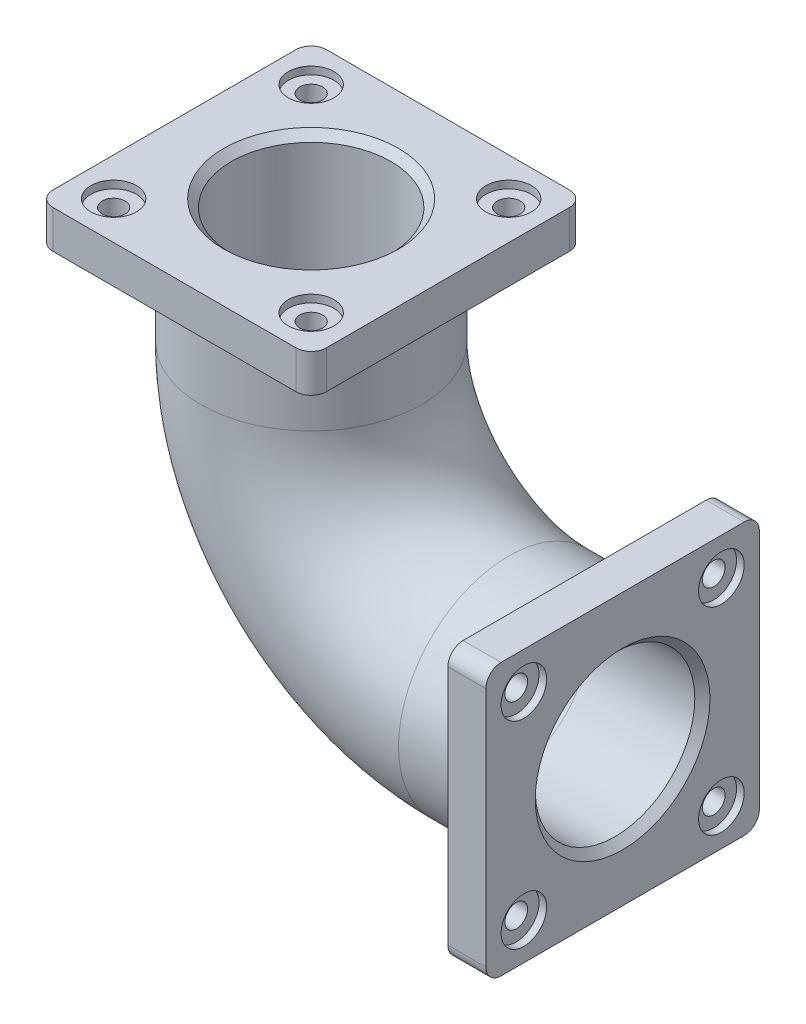
from build123d import *

# Parameters (mm, degrees)
SCHIZZO2_R                   = 145
SCHIZZO2_R_2                 = 105
ESTRUSIONE_ESTRUSIONE2_START = -50
SCHIZZO5_W                   = 360
SCHIZZO5_H                   = 357.468314384
SCHIZZO5_R                   = 145
ESTRUSIONE_ESTRUSIONE2_DEPTH = 50
RACCORDO2_R                  = 20
SCHIZZO11_R                  = 145
ESTRUSIONE_ESTRUSIONE3_DEPTH = 50
SCHIZZO12_R                  = 30
TAGLIO_ESTRUSIONE1_DEPTH     = 10
TAGLIO_ESTRUSIONE2_REACH     = 741.709
SCHIZZO13_R                  = 15
RIPETIZIONECIRCOLARE1_COUNT  = 4
SCHIZZO14_R                  = 30
TAGLIO_ESTRUSIONE3_DEPTH     = 10
TAGLIO_ESTRUSIONE4_REACH     = 856.322
SCHIZZO16_R                  = 15
RIPETIZIONECIRCOLARE2_COUNT  = 4
SMUSSO1_SIZE                 = 10


with BuildPart() as part:
    # Sweep-Sottile1: sweep along a path in Schizzo1
    with BuildLine(Plane.XY) as sweep_sottile1_path:
        Line((0, 0), (-150, 0))
        ThreePointArc((-150, 0), (-333.847763109, 76.152236891), (-410, 260))
        Line((-410, 260), (-410, 422.338378292))
    # Schizzo2 → Sweep-Sottile1 (sweep)
    with BuildSketch(Plane(origin=(0, 0, 0), x_dir=(0, 0, -1), z_dir=(1, 0, 0))):
        Circle(SCHIZZO2_R)
        Circle(SCHIZZO2_R_2, mode=Mode.SUBTRACT)
    sweep(path=sweep_sottile1_path.line)

    # Schizzo5 → Estrusione-Estrusione2 (add)
    with BuildSketch(Plane(origin=(0, 0, 0), x_dir=(0, 0, -1), z_dir=(1, 0, 0)).offset(ESTRUSIONE_ESTRUSIONE2_START)):
        Rectangle(SCHIZZO5_W, SCHIZZO5_H)
        with Locations(Location((0, 0, 0), (0, 0, 270))):
            Circle(SCHIZZO5_R, mode=Mode.SUBTRACT)
    extrude(amount=ESTRUSIONE_ESTRUSIONE2_DEPTH)

    # Raccordo2
    raccordo2_edges = [part.edges().sort_by_distance(p)[0] for p in [
        (-25, -178.734157192, -180),
        (-25, -178.734157192, 180),
        (-25, 178.734157192, 180),
        (-25, 178.734157192, -180),
    ]]
    fillet(raccordo2_edges, radius=RACCORDO2_R)

    # Schizzo11 → Estrusione-Estrusione3 (add)
    with BuildSketch(Plane(origin=(0, 422.338378292, 0), x_dir=(1, 0, 0), z_dir=(0, 1, 0))):
        with BuildLine():
            ThreePointArc((-250, 180), (-235.857864376, 174.142135624), (-230, 160))
            Line((-230, 160), (-230, -160))
            ThreePointArc((-230, -160), (-235.857864376, -174.142135624), (-250, -180))
            Line((-250, -180), (-570, -180))
            ThreePointArc((-570, -180), (-584.142135624, -174.142135624), (-590, -160))
            Line((-590, -160), (-590, 160))
            ThreePointArc((-590, 160), (-584.142135624, 174.142135624), (-570, 180))
            Line((-570, 180), (-250, 180))
        make_face()
        with Locations(Location((-410, 0, 0), (0, 0, 270))):
            Circle(SCHIZZO11_R, mode=Mode.SUBTRACT)
    extrude(amount=-ESTRUSIONE_ESTRUSIONE3_DEPTH)

    # Schizzo12 → Taglio-Estrusione1 (cut)
    with BuildSketch(Plane(origin=(0, 0, 0), x_dir=(0, 0, -1), z_dir=(1, 0, 0))):
        with Locations((-130, 130)):
            Circle(SCHIZZO12_R)
    taglio_estrusione1 = extrude(amount=-TAGLIO_ESTRUSIONE1_DEPTH, mode=Mode.SUBTRACT)

    # Schizzo13 → Taglio-Estrusione2 (cut, up to next)
    with BuildSketch(Plane(origin=(-10, 0, 0), x_dir=(0, 0, -1), z_dir=(1, 0, 0)), mode=Mode.PRIVATE) as taglio_estrusione2_sk1:
        with Locations((-130, 130)):
            Circle(SCHIZZO13_R)
    taglio_estrusione2_tool1 = extrude(taglio_estrusione2_sk1.sketch, amount=-TAGLIO_ESTRUSIONE2_REACH, mode=Mode.PRIVATE) & part.part
    taglio_estrusione2 = taglio_estrusione2_tool1.solids().sort_by_distance((-10, 130, 130))[0]
    add(taglio_estrusione2, mode=Mode.SUBTRACT)

    # RipetizioneCircolare1: Taglio-Estrusione1, Taglio-Estrusione2 ×4 about axis
    ripetizionecircolare1_axis = Axis((0, 0, 0), (1, 0, 0))
    add([taglio_estrusione1.rotate(ripetizionecircolare1_axis, i * 360 / RIPETIZIONECIRCOLARE1_COUNT) for i in range(1, RIPETIZIONECIRCOLARE1_COUNT)], mode=Mode.SUBTRACT)
    add([taglio_estrusione2.rotate(ripetizionecircolare1_axis, i * 360 / RIPETIZIONECIRCOLARE1_COUNT) for i in range(1, RIPETIZIONECIRCOLARE1_COUNT)], mode=Mode.SUBTRACT)

    # Schizzo14 → Taglio-Estrusione3 (cut)
    with BuildSketch(Plane(origin=(0, 422.338378292, 0), x_dir=(1, 0, 0), z_dir=(0, 1, 0))):
        with Locations(Location((-540, 130, 0), (0, 0, 270))):
            Circle(SCHIZZO14_R)
    taglio_estrusione3 = extrude(amount=-TAGLIO_ESTRUSIONE3_DEPTH, mode=Mode.SUBTRACT)

    # Schizzo16 → Taglio-Estrusione4 (cut, up to next)
    with BuildSketch(Plane(origin=(0, 412.338378292, 0), x_dir=(1, 0, 0), z_dir=(0, 1, 0)), mode=Mode.PRIVATE) as taglio_estrusione4_sk1:
        with Locations(Location((-540, 130, 0), (0, 0, 270))):
            Circle(SCHIZZO16_R)
    taglio_estrusione4_tool1 = extrude(taglio_estrusione4_sk1.sketch, amount=-TAGLIO_ESTRUSIONE4_REACH, mode=Mode.PRIVATE) & part.part
    taglio_estrusione4 = taglio_estrusione4_tool1.solids().sort_by_distance((-540, 412.338378, -130))[0]
    add(taglio_estrusione4, mode=Mode.SUBTRACT)

    # RipetizioneCircolare2: Taglio-Estrusione3, Taglio-Estrusione4 ×4 about axis
    ripetizionecircolare2_axis = Axis((-410, 0, 0), (0, 1, 0))
    add([taglio_estrusione3.rotate(ripetizionecircolare2_axis, i * 360 / RIPETIZIONECIRCOLARE2_COUNT) for i in range(1, RIPETIZIONECIRCOLARE2_COUNT)], mode=Mode.SUBTRACT)
    add([taglio_estrusione4.rotate(ripetizionecircolare2_axis, i * 360 / RIPETIZIONECIRCOLARE2_COUNT) for i in range(1, RIPETIZIONECIRCOLARE2_COUNT)], mode=Mode.SUBTRACT)

    # Smusso1
    smusso1_edges = [part.edges().sort_by_distance(p)[0] for p in [
        (0, 0, 105),
        (-410, 422.338378292, 105),
    ]]
    chamfer(smusso1_edges, length=SMUSSO1_SIZE)


solid = part.part
